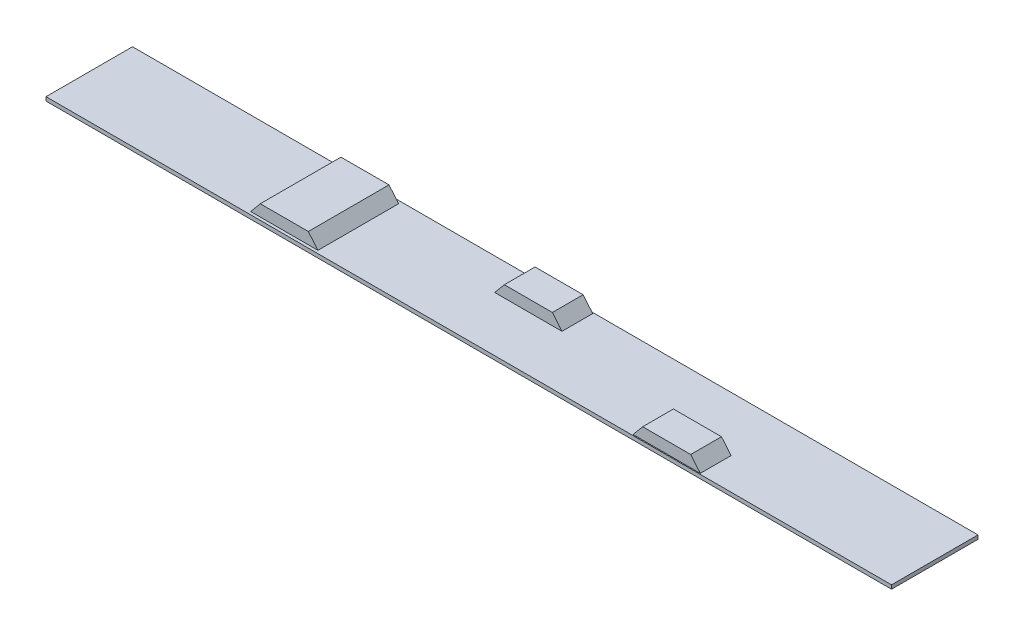
from build123d import *

# Parameters (mm, degrees)
SKETCH1_W           = 2200
SKETCH1_H           = 225
BOSS_EXTRUDE1_DEPTH = 10
BOSS_EXTRUDE2_START = 30
BOSS_EXTRUDE2_DEPTH = 80
BOSS_EXTRUDE3_START = -30
BOSS_EXTRUDE3_DEPTH = 80
BOSS_EXTRUDE4_DEPTH = 105


with BuildPart() as part:
    # Sketch1 → Boss-Extrude1 (new body)
    with BuildSketch(Plane(origin=(0, 0, 0), x_dir=(1, 0, 0), z_dir=(0, 1, 0))):
        Rectangle(SKETCH1_W, SKETCH1_H)
    extrude(amount=BOSS_EXTRUDE1_DEPTH)

    # Sketch2 → Boss-Extrude2 (add)
    with BuildSketch(Plane.XY.offset(BOSS_EXTRUDE2_START)):
        Polygon((425, 10), (450, 40), (575, 40), (600, 10), align=None)
    extrude(amount=BOSS_EXTRUDE2_DEPTH)

    # Sketch3 → Boss-Extrude3 (add)
    with BuildSketch(Plane.XY.offset(BOSS_EXTRUDE3_START)):
        Polygon((75, 40), (-50, 40), (-75, 10), (100, 10), align=None)
    extrude(amount=-BOSS_EXTRUDE3_DEPTH)

    # Sketch4 → Boss-Extrude4 (add, symmetric)
    with BuildSketch(Plane.XY):
        Polygon((-425, 40), (-550, 40), (-575, 10), (-400, 10), align=None)
    extrude(amount=BOSS_EXTRUDE4_DEPTH, both=True)


solid = part.part
